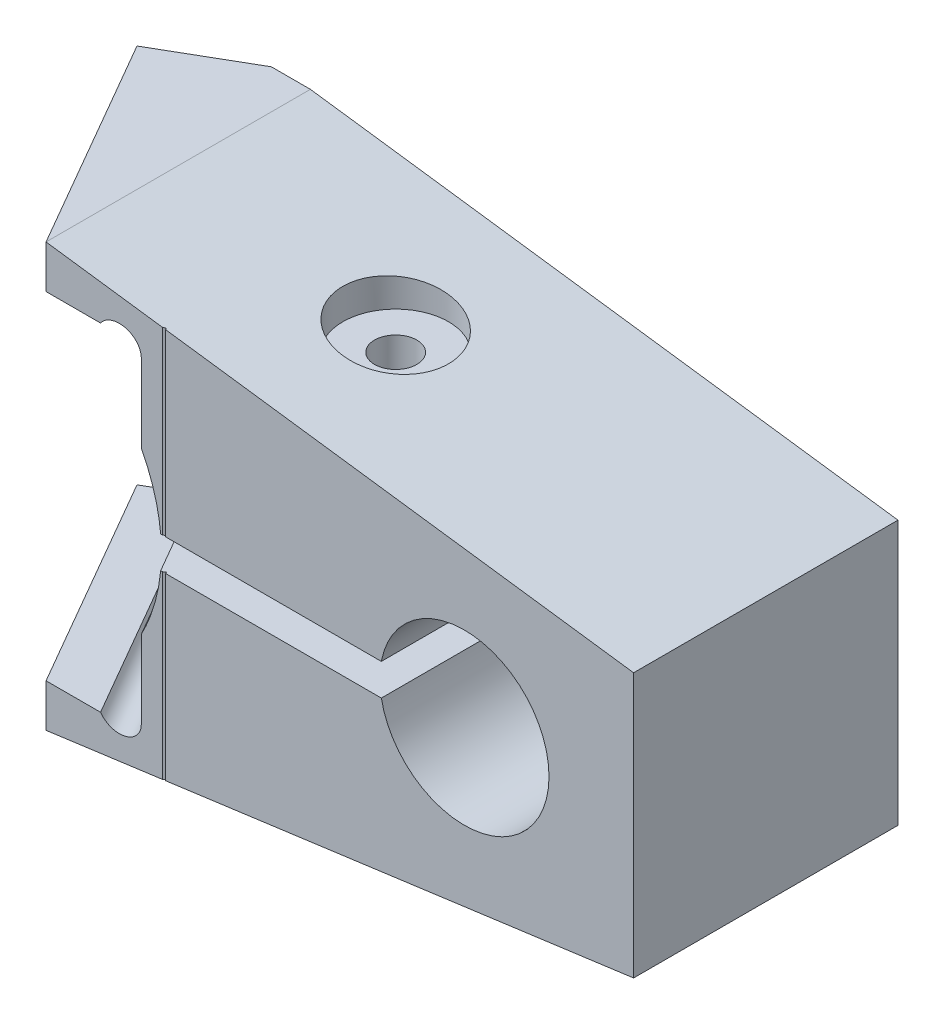
from build123d import *

# Parameters (mm, degrees)
BOSS_EXTRUDE1_DEPTH     = 40
CUT_EXTRUDE1_DEPTH      = 40
SKETCH3_W               = 4.376715803
SKETCH3_H               = 7.921330006
BOSS_EXTRUDE2_DEPTH     = 40
CUT_EXTRUDE2_DEPTH      = 78.145313728
CUT_EXTRUDE2_DEPTH_BACK = 78.145313728
CUT_EXTRUDE3_DEPTH      = 40
CUT_EXTRUDE4_DEPTH      = 43.935998882
CUT_EXTRUDE4_DEPTH_BACK = 43.935998882
SKETCH6_R               = 2
CUT_EXTRUDE5_DEPTH      = 5
SKETCH8_R               = 5
CUT_EXTRUDE6_DEPTH      = 5
CUT_EXTRUDE7_START      = -2
SKETCH9_W               = 6.222682415
SKETCH9_H               = 53.403341902
CUT_EXTRUDE7_DEPTH      = 16


with BuildPart() as part:
    # Sketch1 → Boss-Extrude1 (new body)
    with BuildSketch(Plane(origin=(0, 0, 0), x_dir=(1, 0, 0), z_dir=(0, 1, 0))):
        Polygon((-35, 12.5), (-20.56624327, -12.5), (35, -12.5), (35, 12.5), align=None)
    extrude(amount=BOSS_EXTRUDE1_DEPTH)

    # Sketch2 → Cut-Extrude1 (cut)
    with BuildSketch(Plane.XY.offset(12.5)):
        Polygon((-20.56624327, 40), (35, 32.5), (35, 40), align=None)
        Polygon((35, 7.5), (-20.56624327, 0), (35, 0), align=None)
    extrude(amount=-CUT_EXTRUDE1_DEPTH, mode=Mode.SUBTRACT)

    # Sketch3 → Boss-Extrude2 (add)
    with BuildSketch(Plane(origin=(-20.837341226, 0, 12.030444566), x_dir=(0.4999999999999981, 0, 0.8660254037844397), z_dir=(-0.8660254037844398, 0, 0.4999999999999982))):
        with Locations((-10.675795445, 21.421253709)):
            Rectangle(SKETCH3_W, SKETCH3_H)
    extrude(amount=BOSS_EXTRUDE2_DEPTH)

    # Sketch4 → Cut-Extrude2 (cut, two sides: drawn at the far end of the back side and taken through both)
    with BuildSketch(Plane(origin=(-4.243718771, 0, -7.350336525), x_dir=(0.8660254037844397, 0, -0.4999999999999983), z_dir=(0.4999999999999982, 0, 0.8660254037844396)).offset(-CUT_EXTRUDE2_DEPTH_BACK)):
        with BuildLine():
            Line((-25.260889132, 35.934120187), (-19.597573928, 35.934120187))
            ThreePointArc((-19.597573928, 35.934120187), (-17.574079433, 36.729704946), (-16.260889132, 34.996783621))
            Line((-16.260889132, 34.996783621), (-16.260889132, 27.623217913))
            ThreePointArc((-16.260889132, 27.623217913), (-14.610889132, 19.996783621), (-16.260889132, 12.37034933))
            Line((-16.260889132, 12.37034933), (-16.260889132, 4.996783621))
            ThreePointArc((-16.260889132, 4.996783621), (-17.574079433, 3.263862297), (-19.597573928, 4.059447055))
            Line((-19.597573928, 4.059447055), (-25.260889132, 4.059447055))
            Line((-25.260889132, 4.059447055), (-25.260889132, 11.549622397))
            Line((-25.260889132, 11.549622397), (-69.354192402, 11.549622397))
            Line((-69.354192402, 11.549622397), (-69.354192402, 27.546843348))
            Line((-69.354192402, 27.546843348), (-25.260889132, 26.613076168))
            Line((-25.260889132, 26.613076168), (-25.260889132, 35.934120187))
        make_face()
    extrude(amount=CUT_EXTRUDE2_DEPTH + CUT_EXTRUDE2_DEPTH_BACK, mode=Mode.SUBTRACT)

    # Sketch5 → Cut-Extrude3 (cut)
    with BuildSketch(Plane(origin=(0, 0, -12.5), x_dir=(-1, 0, 0), z_dir=(0, 0, -1))):
        with BuildLine():
            Line((-11.141275202, 21.5), (29.874932975, 21.5))
            Line((29.874932975, 21.5), (29.874932975, 18.5))
            Line((29.874932975, 18.5), (-11.142492493, 18.5))
            ThreePointArc((-11.142492493, 18.5), (-26.999999341, 20.006434648), (-11.141275202, 21.5))
        make_face()
    extrude(amount=-CUT_EXTRUDE3_DEPTH, mode=Mode.SUBTRACT)

    # Sketch6 → Cut-Extrude4 (cut, two sides: drawn at the far end of the back side and taken through both)
    with BuildSketch(Plane(origin=(0, 18.5, 0), x_dir=(1, 0, 0), z_dir=(0, 1, 0)).offset(-CUT_EXTRUDE4_DEPTH_BACK)):
        Circle(SKETCH6_R)
    extrude(amount=CUT_EXTRUDE4_DEPTH + CUT_EXTRUDE4_DEPTH_BACK, mode=Mode.SUBTRACT)

    # Sketch7 → Cut-Extrude5 (cut)
    with BuildSketch(Plane.XZ):
        Polygon((1.8525736, 3.461402084), (-2.071375338, 3.335076842), (-3.923948938, -0.126325242), (-1.8525736, -3.461402084), (2.071375338, -3.335076842), (3.923948938, 0.126325242), align=None)
    extrude(amount=-CUT_EXTRUDE5_DEPTH, mode=Mode.SUBTRACT)

    # Sketch8 → Cut-Extrude6 (cut)
    with BuildSketch(Plane(origin=(0, 40, 0), x_dir=(1, 0, 0), z_dir=(0, 1, 0))):
        with Locations(Location((0, 0, 0), (0, 0, 270))):
            Circle(SKETCH8_R)
    extrude(amount=-CUT_EXTRUDE6_DEPTH, mode=Mode.SUBTRACT)

    # Sketch9 → Cut-Extrude7 (cut)
    with BuildSketch(Plane(origin=(-14.082343077, 0, 8.130444566), x_dir=(0.4999999999999982, 0, 0.8660254037844397), z_dir=(-0.8660254037844398, 0, 0.4999999999999983)).offset(CUT_EXTRUDE7_START)):
        with Locations((-26.065813196, 19.047949313)):
            Rectangle(SKETCH9_W, SKETCH9_H)
        Polygon((6.045528012, 45.749620264), (6.045528012, -7.653721638), (13.717164193, -7.653721638), (13.717164193, 42.686575292), (13.717164193, 45.749620264), align=None)
    extrude(amount=CUT_EXTRUDE7_DEPTH, mode=Mode.SUBTRACT)


solid = part.part
